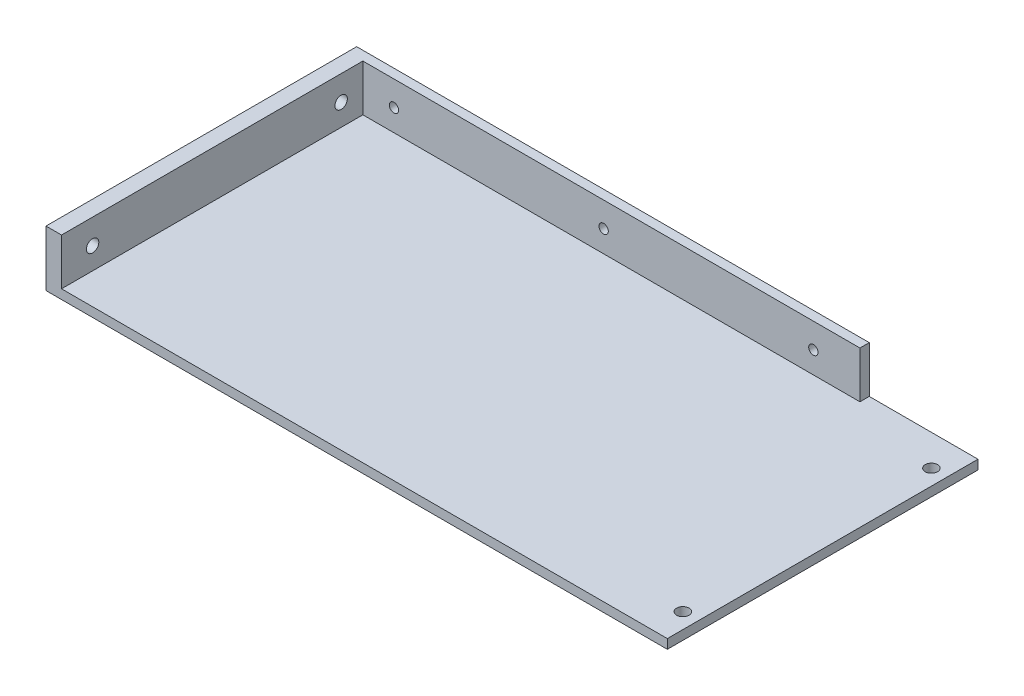
from build123d import *

# Parameters (mm, degrees)
SKETCH1_W           = 200
SKETCH1_H           = 100
BOSS_EXTRUDE1_DEPTH = 3
SKETCH2_W           = 5
SKETCH2_H           = 100
BOSS_EXTRUDE2_DEPTH = 15
CUT_EXTRUDE1_REACH  = 208.94
SKETCH3_R           = 2
LPATTERN1_COUNT     = 2
LPATTERN1_PITCH     = 80
CUT_EXTRUDE2_REACH  = 114.805
SKETCH4_R           = 2
LPATTERN2_COUNT     = 2
LPATTERN2_PITCH     = 80
SKETCH5_W           = 160
SKETCH5_H           = 3
BOSS_EXTRUDE3_DEPTH = 15
CUT_EXTRUDE3_REACH  = 144.562
SKETCH6_R           = 1.5


with BuildPart() as part:
    # Sketch1 → Boss-Extrude1 (new body)
    with BuildSketch(Plane(origin=(0, 0, 0), x_dir=(1, 0, 0), z_dir=(0, 1, 0))):
        Rectangle(SKETCH1_W, SKETCH1_H)
    extrude(amount=BOSS_EXTRUDE1_DEPTH)

    # Sketch2 → Boss-Extrude2 (add)
    with BuildSketch(Plane(origin=(0, 3, 0), x_dir=(1, 0, 0), z_dir=(0, 1, 0))):
        with Locations((-97.5, 0)):
            Rectangle(SKETCH2_W, SKETCH2_H)
    extrude(amount=BOSS_EXTRUDE2_DEPTH)

    # Sketch3 → Cut-Extrude1 (cut, up to next)
    with BuildSketch(Plane.ZY.offset(100), mode=Mode.PRIVATE) as cut_extrude1_sk1:
        with Locations((40, 10)):
            Circle(SKETCH3_R)
    cut_extrude1_tool1 = extrude(cut_extrude1_sk1.sketch, amount=-CUT_EXTRUDE1_REACH, mode=Mode.PRIVATE) & part.part
    cut_extrude1 = cut_extrude1_tool1.solids().sort_by_distance((-100, 10, 40))[0]
    add(cut_extrude1, mode=Mode.SUBTRACT)

    # LPattern1: Cut-Extrude1 ×2
    with Locations(*[(0, 0, -i * LPATTERN1_PITCH) for i in range(1, LPATTERN1_COUNT)]):
        add(cut_extrude1, mode=Mode.SUBTRACT)

    # Sketch4 → Cut-Extrude2 (cut, up to next)
    with BuildSketch(Plane(origin=(0, 3, 0), x_dir=(1, 0, 0), z_dir=(0, 1, 0)), mode=Mode.PRIVATE) as cut_extrude2_sk1:
        with Locations(Location((95, 40, 0), (0, 0, 270))):
            Circle(SKETCH4_R)
    cut_extrude2_tool1 = extrude(cut_extrude2_sk1.sketch, amount=-CUT_EXTRUDE2_REACH, mode=Mode.PRIVATE) & part.part
    cut_extrude2 = cut_extrude2_tool1.solids().sort_by_distance((95, 3, -40))[0]
    add(cut_extrude2, mode=Mode.SUBTRACT)

    # LPattern2: Cut-Extrude2 ×2
    with Locations(*[(0, 0, i * LPATTERN2_PITCH) for i in range(1, LPATTERN2_COUNT)]):
        add(cut_extrude2, mode=Mode.SUBTRACT)

    # Sketch5 → Boss-Extrude3 (add)
    with BuildSketch(Plane(origin=(0, 3, 0), x_dir=(1, 0, 0), z_dir=(0, 1, 0))):
        with Locations((-15, 48.5)):
            Rectangle(SKETCH5_W, SKETCH5_H)
    extrude(amount=BOSS_EXTRUDE3_DEPTH)

    # Sketch6 → Cut-Extrude3 (cut, up to next)
    with BuildSketch(Plane(origin=(0, 0, -50), x_dir=(-1, 0, 0), z_dir=(0, 0, -1)), mode=Mode.PRIVATE) as cut_extrude3_sk1:
        with Locations((85, 10)):
            Circle(SKETCH6_R)
    cut_extrude3_tool1 = extrude(cut_extrude3_sk1.sketch, amount=-CUT_EXTRUDE3_REACH, mode=Mode.PRIVATE) & part.part
    # Sketch6 → Cut-Extrude3 (cut, up to next)
    with BuildSketch(Plane(origin=(0, 0, -50), x_dir=(-1, 0, 0), z_dir=(0, 0, -1)), mode=Mode.PRIVATE) as cut_extrude3_sk2:
        with Locations((17.5, 10)):
            Circle(SKETCH6_R)
    cut_extrude3_tool2 = extrude(cut_extrude3_sk2.sketch, amount=-CUT_EXTRUDE3_REACH, mode=Mode.PRIVATE) & part.part
    # Sketch6 → Cut-Extrude3 (cut, up to next)
    with BuildSketch(Plane(origin=(0, 0, -50), x_dir=(-1, 0, 0), z_dir=(0, 0, -1)), mode=Mode.PRIVATE) as cut_extrude3_sk3:
        with Locations((-50, 10)):
            Circle(SKETCH6_R)
    cut_extrude3_tool3 = extrude(cut_extrude3_sk3.sketch, amount=-CUT_EXTRUDE3_REACH, mode=Mode.PRIVATE) & part.part
    add(cut_extrude3_tool1.solids().sort_by_distance((-85, 10, -50))[0], mode=Mode.SUBTRACT)
    add(cut_extrude3_tool2.solids().sort_by_distance((-17.5, 10, -50))[0], mode=Mode.SUBTRACT)
    add(cut_extrude3_tool3.solids().sort_by_distance((50, 10, -50))[0], mode=Mode.SUBTRACT)


solid = part.part
